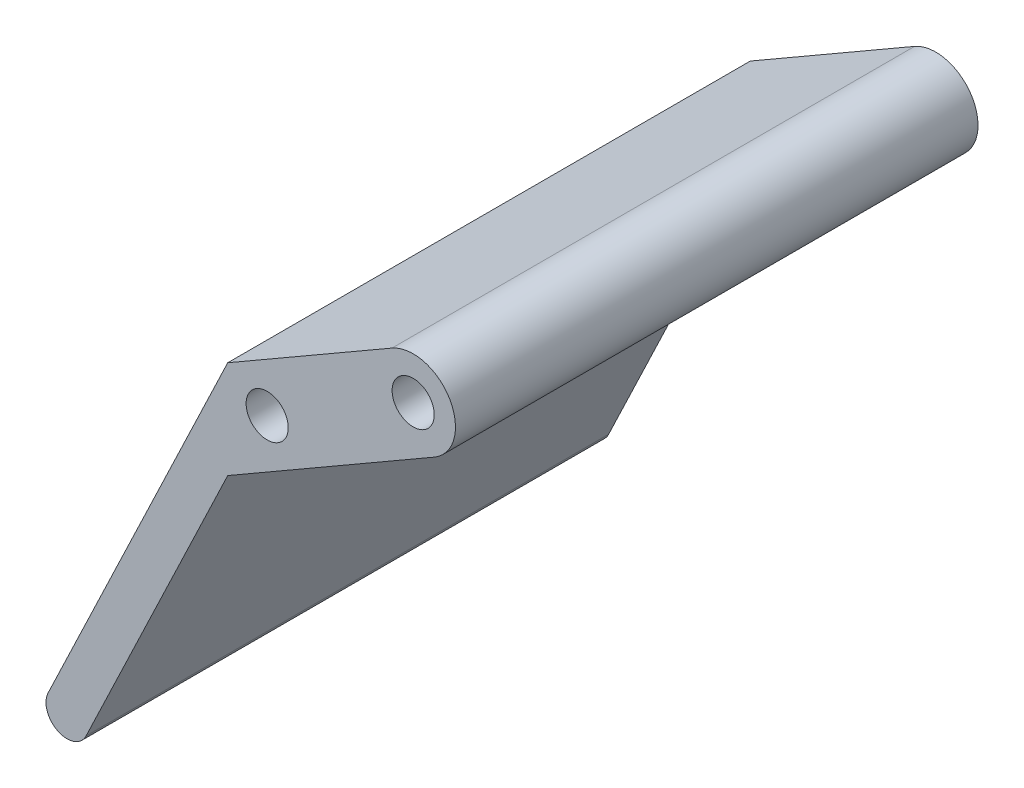
from build123d import *

# Parameters (mm, degrees)
SKETCH_1_R               = 10
SKETCH_1_R_2             = 2.5
EXTRUDE_1_DEPTH          = 70
SKETCH_2_W               = 60
SKETCH_2_H               = 70
SKETCH_2_H_2             = 67.94057246
CUT_EXTRUDE_1_DEPTH      = 70
EXTRUDE_2_DEPTH          = 60
CUT_EXTRUDE_3_DEPTH      = 129.790186287
CUT_EXTRUDE_3_DEPTH_BACK = 129.790186287
SKETCH_6_R               = 2.5
CUT_EXTRUDE_4_DEPTH      = 132.384596068
CUT_EXTRUDE_4_DEPTH_BACK = 132.384596068
SKETCH_7_W               = 40.15837314
SKETCH_7_H               = 126.534822783
SKETCH_7_W_2             = 29.990396309
SKETCH_7_H_2             = 127.151063803
SKETCH_8_R               = 2.5
EXTRUDE_4_DEPTH          = 2


with BuildPart() as part:
    # 草图1 → 凸台-拉伸1 (new body)
    with BuildSketch(Plane.XY):
        with BuildLine():
            Line((-15, 90), (-15, 0))
            ThreePointArc((-15, 0), (0, -15), (15, 0))
            Line((15, 0), (15, 90))
            ThreePointArc((15, 90), (0, 105), (-15, 90))
        make_face()
        Circle(SKETCH_1_R, mode=Mode.SUBTRACT)
        with Locations((0, 90)):
            Circle(SKETCH_1_R_2, mode=Mode.SUBTRACT)
    extrude(amount=EXTRUDE_1_DEPTH)

    # 草图2 → 切除-拉伸1 (cut)
    with BuildSketch(Plane.ZY.offset(15)):
        with Locations((35, 80)):
            Rectangle(SKETCH_2_W, SKETCH_2_H)
        with Locations((35, 11.02971377)):
            Rectangle(SKETCH_2_W, SKETCH_2_H_2)
    extrude(amount=-CUT_EXTRUDE_1_DEPTH, mode=Mode.SUBTRACT)


with BuildPart() as cut_extrude_1_piece_1:
    # of the separate pieces the step leaves, piece 1, a body of its own (cut_extrude_1_pieces)
    add(part.part.solids().sort_by_distance((15, 0, 0))[0])



with BuildPart() as cut_extrude_1_piece_2:
    # of the separate pieces the step leaves, piece 2, a body of its own (cut_extrude_1_pieces)
    add(part.part.solids().sort_by_distance((15, 0, 65))[0])


with BuildPart() as cut_extrude_1_piece_1_1:
    add(cut_extrude_1_piece_1.part)

    add(cut_extrude_1_piece_2.part)  # 凸台-拉伸2 merges 切除-拉伸1 piece 2
    # 草图4 → 凸台-拉伸2 (add)
    with BuildSketch(Plane(origin=(0, 0, 65), x_dir=(-1, 0, 0), z_dir=(0, 0, -1))):
        with BuildLine():
            Line((-4.490156776, 68.758657712), (15, 57.50601045))
            Line((15, 57.50601045), (36.319312502, 12.911360415))
            ThreePointArc((36.319312502, 12.911360415), (35.142094618, 9.577570071), (31.808304274, 10.754787955))
            Line((31.808304274, 10.754787955), (15, 45.913541163))
            Line((15, 45.913541163), (-9.509843224, 60.064305746))
            ThreePointArc((-9.509843224, 60.064305746), (-11.347175983, 66.921324953), (-4.490156776, 68.758657712))
        make_face()
    extrude(amount=EXTRUDE_2_DEPTH)

    # 草图6 → 切除-拉伸3 (cut, two sides: drawn at the far end of the back side and taken through both)
    with BuildSketch(Plane(origin=(0, 0, 65), x_dir=(-1, 0, 0), z_dir=(0, 0, -1)).offset(-CUT_EXTRUDE_3_DEPTH_BACK)):
        with Locations(Location((-7, 64.411481729, 0), (0, 0, 90))):
            Circle(SKETCH_6_R)
        with Locations(Location((-11.650635095, 53.212249296, 0), (0, 0, 90))):
            Circle(SKETCH_6_R)
        with Locations(Location((10, 40.712249296, 0), (0, 0, 90))):
            Circle(SKETCH_6_R)
        with Locations(Location((10.320508076, 54.411481729, 0), (0, 0, 90))):
            Circle(SKETCH_6_R)
    extrude(amount=CUT_EXTRUDE_3_DEPTH + CUT_EXTRUDE_3_DEPTH_BACK, mode=Mode.SUBTRACT)

    # 草图7 → 切除-拉伸4 (cut, two sides: drawn at the far end of the back side and taken through both)
    with BuildSketch(Plane(origin=(0, 0, 0), x_dir=(0, 0, -1), z_dir=(1, 0, 0)).offset(-CUT_EXTRUDE_4_DEPTH_BACK)):
        with Locations((15.07918657, 44.332405561)):
            Rectangle(SKETCH_7_W, SKETCH_7_H)
        with Locations((-79.995198155, 44.024285052)):
            Rectangle(SKETCH_7_W_2, SKETCH_7_H_2)
    extrude(amount=CUT_EXTRUDE_4_DEPTH + CUT_EXTRUDE_4_DEPTH_BACK, mode=Mode.SUBTRACT)

    # 草图8 → 凸台-拉伸4 (add)
    with BuildSketch(Plane(origin=(0, 0, 5), x_dir=(-1, 0, 0), z_dir=(0, 0, -1))):
        with BuildLine():
            Line((36.319312502, 12.911360415), (15, 57.50601045))
            Line((15, 57.50601045), (-4.490156776, 68.758657712))
            ThreePointArc((-4.490156776, 68.758657712), (-11.347175983, 66.921324953), (-9.509843224, 60.064305746))
            Line((-9.509843224, 60.064305746), (15, 45.913541163))
            Line((15, 45.913541163), (31.808304274, 10.754787955))
            ThreePointArc((31.808304274, 10.754787955), (35.142094618, 9.577570071), (36.319312502, 12.911360415))
        make_face()
        with Locations(Location((-7, 64.411481729, 0), (0, 0, 90))):
            Circle(SKETCH_8_R, mode=Mode.SUBTRACT)
        with Locations(Location((10.320508076, 54.411481729, 0), (0, 0, 90))):
            Circle(SKETCH_8_R, mode=Mode.SUBTRACT)
    extrude(amount=EXTRUDE_4_DEPTH)


solid = cut_extrude_1_piece_1_1.part
